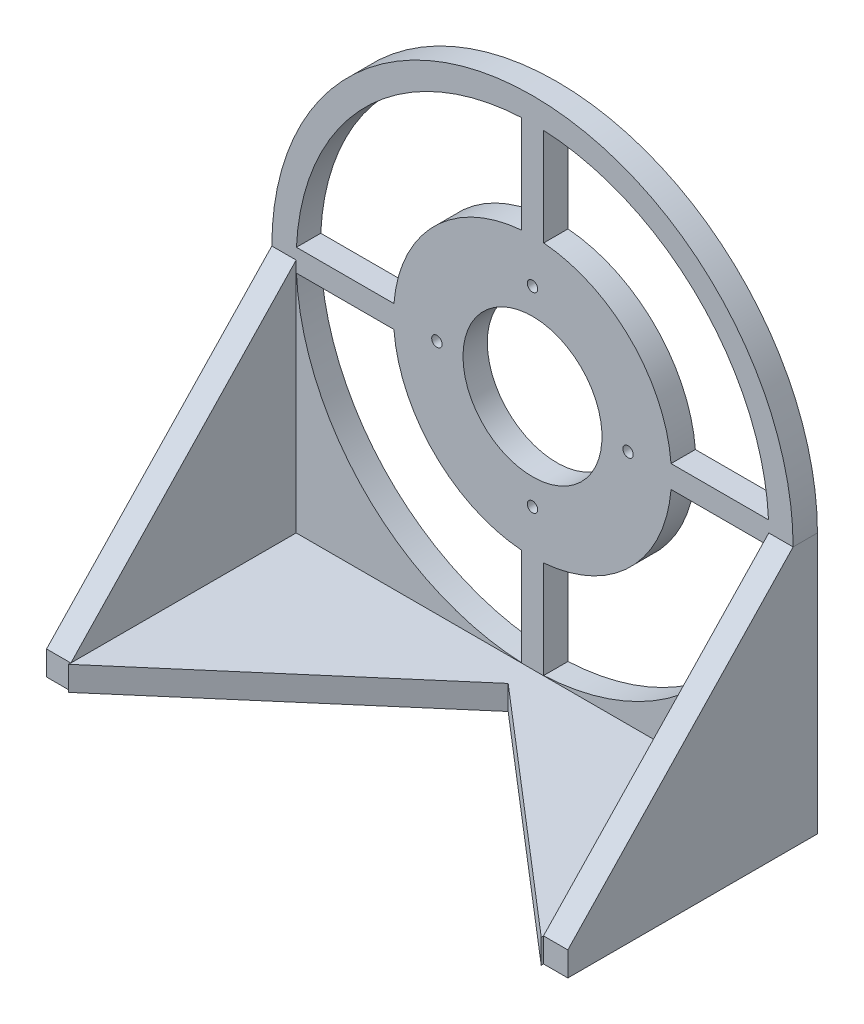
from build123d import *

# Parameters (mm, degrees)
SKETCH_1_R          = 75
SKETCH_1_R_2        = 1.5
SKETCH_1_R_3        = 20
EXTRUDE_1_DEPTH     = 7
SKETCH_2_R          = 2.5
CUT_EXTRUDE_1_DEPTH = 4
EXTRUDE_2_DEPTH     = 7
EXTRUDE_3_DEPTH     = 7
EXTRUDE_4_DEPTH     = 7
SKETCH_6_W          = 6.673333333
SKETCH_6_H          = 7
CUT_EXTRUDE_2_DEPTH = 7


with BuildPart() as part:
    # 草图1 → 凸台-拉伸1 (new body)
    with BuildSketch(Plane.XY):
        with Locations(Location((0, 0, 0), (0, 0, 180))):
            Circle(SKETCH_1_R)
        with BuildLine():
            ThreePointArc((-3.219389508, -67.923747918), (-48.083261121, -48.083261121), (-67.923747918, -3.219389508))
            Line((-67.923747918, -3.219389508), (-59, -3.219389508))
            Line((-59, -3.219389508), (-39.870233649, -3.219389508))
            ThreePointArc((-39.870233649, -3.219389508), (-28.284271247, -28.284271247), (-3.219389508, -39.870233649))
            Line((-3.219389508, -39.870233649), (-3.219389508, -67.923747918))
        make_face(mode=Mode.SUBTRACT)
        with Locations(Location((0, -27.5, 0), (0, 0, 180))):
            Circle(SKETCH_1_R_2, mode=Mode.SUBTRACT)
        with BuildLine():
            Line((39.870233649, -3.219389508), (67.923747918, -3.219389508))
            ThreePointArc((67.923747918, -3.219389508), (48.083261121, -48.083261121), (3.219389508, -67.923747918))
            Line((3.219389508, -67.923747918), (3.219389508, -59))
            Line((3.219389508, -59), (3.219389508, -39.870233649))
            ThreePointArc((3.219389508, -39.870233649), (28.284271247, -28.284271247), (39.870233649, -3.219389508))
        make_face(mode=Mode.SUBTRACT)
        with Locations(Location((27.5, 0, 0), (0, 0, 180))):
            Circle(SKETCH_1_R_2, mode=Mode.SUBTRACT)
        with Locations(Location((-27.5, 0, 0), (0, 0, 180))):
            Circle(SKETCH_1_R_2, mode=Mode.SUBTRACT)
        with BuildLine():
            ThreePointArc((-67.923747918, 3.219389508), (-48.083261121, 48.083261121), (-3.219389508, 67.923747918))
            Line((-3.219389508, 67.923747918), (-3.219389508, 59))
            Line((-3.219389508, 59), (-3.219389508, 39.870233649))
            ThreePointArc((-3.219389508, 39.870233649), (-28.284271247, 28.284271247), (-39.870233649, 3.219389508))
            Line((-39.870233649, 3.219389508), (-59.015976915, 3.219389508))
            Line((-59.015976915, 3.219389508), (-67.923747918, 3.219389508))
        make_face(mode=Mode.SUBTRACT)
        with Locations(Location((0, 0, 0), (0, 0, 180))):
            Circle(SKETCH_1_R_3, mode=Mode.SUBTRACT)
        with Locations(Location((0, 27.5, 0), (0, 0, 180))):
            Circle(SKETCH_1_R_2, mode=Mode.SUBTRACT)
        with BuildLine():
            Line((3.219389508, 39.870233649), (3.219389508, 67.923747918))
            ThreePointArc((3.219389508, 67.923747918), (48.083261121, 48.083261121), (67.923747918, 3.219389508))
            Line((67.923747918, 3.219389508), (59, 3.219389508))
            Line((59, 3.219389508), (39.870233649, 3.219389508))
            ThreePointArc((39.870233649, 3.219389508), (28.284271247, 28.284271247), (3.219389508, 39.870233649))
        make_face(mode=Mode.SUBTRACT)
    extrude(amount=EXTRUDE_1_DEPTH)

    # 草图2 → 切除-拉伸1 (cut)
    with BuildSketch(Plane.XY):
        with Locations((27.5, 0)):
            Circle(SKETCH_2_R)
        with Locations((0, -27.5)):
            Circle(SKETCH_2_R)
        with Locations((-27.5, 0)):
            Circle(SKETCH_2_R)
        with Locations((0, 27.5)):
            Circle(SKETCH_2_R)
    extrude(amount=CUT_EXTRUDE_1_DEPTH, mode=Mode.SUBTRACT)

    # 草图3 → 凸台-拉伸2 (add)
    with BuildSketch(Plane(origin=(0, -75, 0), x_dir=(1, 0, 0), z_dir=(0, 1, 0))):
        Polygon((-75, 0), (-75, -3.5), (-75, -78.5), (0, -14), (75, -78.5), (75, 0), (0, 0), align=None)
    extrude(amount=EXTRUDE_2_DEPTH)

    # 草图4 → 凸台-拉伸3 (add)
    with BuildSketch(Plane.XY):
        with BuildLine():
            Line((-75, 0), (-75, -75))
            Line((-75, -75), (75, -75))
            Line((75, -75), (75, 0))
            Line((75, 0), (68, 0))
            ThreePointArc((68, 0), (0, -68), (-68, 0))
            Line((-68, 0), (-75, 0))
        make_face()
    extrude(amount=EXTRUDE_3_DEPTH)

    # 草图5 → 凸台-拉伸4 (add)
    with BuildSketch(Plane(origin=(-75, 0, 0), x_dir=(0, 0, -1), z_dir=(1, 0, 0))):
        Polygon((0, 0), (-7, 0), (-78.5, -75), (0, -75), align=None)
    extrude_4 = extrude(amount=EXTRUDE_4_DEPTH)

    # 镜向1: 凸台-拉伸4 across plane
    add(extrude_4.mirror(Plane(origin=(0, 0, 0), x_dir=(0, 0, 1), z_dir=(1, 0, 0))))

    # 草图6 → 切除-拉伸2 (cut)
    with BuildSketch(Plane(origin=(-75, 0, 0), x_dir=(0, 0, -1), z_dir=(1, 0, 0))):
        with Locations((-75.163333333, -71.5)):
            Rectangle(SKETCH_6_W, SKETCH_6_H)
    cut_extrude_2 = extrude(amount=CUT_EXTRUDE_2_DEPTH, mode=Mode.SUBTRACT)

    # 镜向5: 切除-拉伸2 across plane
    add(cut_extrude_2.mirror(Plane(origin=(0, 0, 0), x_dir=(0, 0, 1), z_dir=(1, 0, 0))), mode=Mode.SUBTRACT)


solid = part.part
